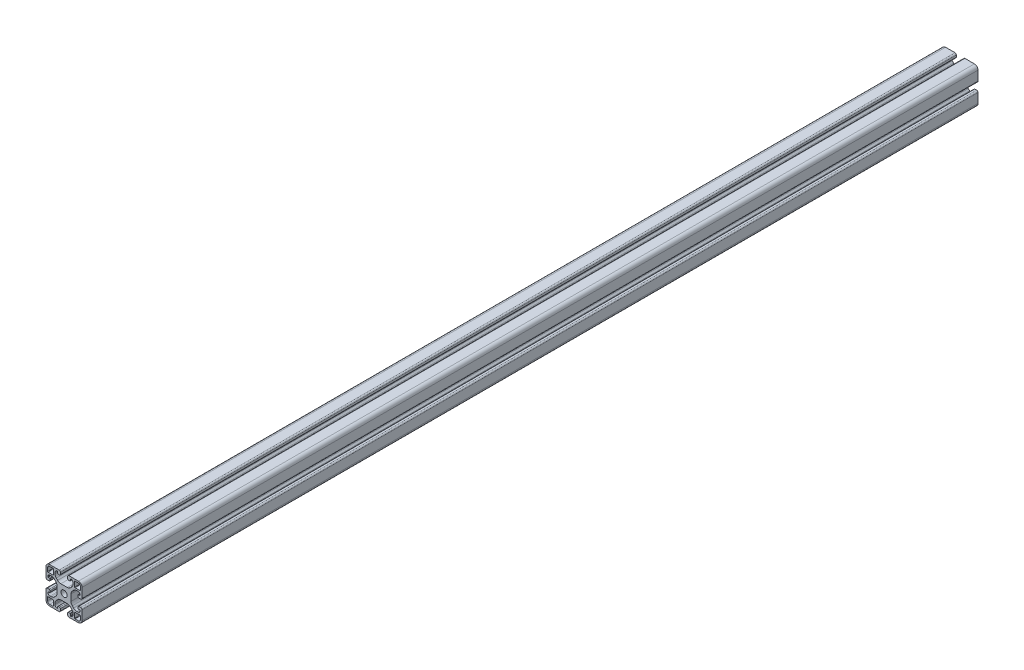
from build123d import *

# Parameters (mm, degrees)
ESQUISSE1_R        = 3.4
BOSS_EXTRU_1_DEPTH = 995


with BuildPart() as part:
    # Esquisse1 → Boss.-Extru.1 (new body)
    with BuildSketch(Plane(origin=(0, 0, -30), x_dir=(-1, 0, 0), z_dir=(0, 0, -1))):
        with BuildLine():
            Line((-4.5, 15), (-4.5, 13.5))
            ThreePointArc((-4.5, 13.5), (-4.353553391, 13.146446609), (-4, 13))
            Line((-4, 13), (-2.5, 13))
            ThreePointArc((-2.5, 13), (-2.146446609, 12.853553391), (-2, 12.5))
            ThreePointArc((-2, 12.5), (-2.732233047, 10.732233047), (-4.5, 10))
            Line((-4.5, 10), (-5.807611845, 10))
            ThreePointArc((-5.807611845, 10), (-7.721029006, 10.380602337), (-9.343145751, 11.464466094))
            Line((-9.343145751, 11.464466094), (-10.785533906, 12.906854249))
            ThreePointArc((-10.785533906, 12.906854249), (-11.869397663, 14.528970994), (-12.25, 16.442388155))
            Line((-12.25, 16.442388155), (-12.25, 23.557611845))
            ThreePointArc((-12.25, 23.557611845), (-11.869397663, 25.471029006), (-10.785533906, 27.093145751))
            Line((-10.785533906, 27.093145751), (-9.343145751, 28.535533906))
            ThreePointArc((-9.343145751, 28.535533906), (-7.721029006, 29.619397663), (-5.807611845, 30))
            Line((-5.807611845, 30), (-4.5, 30))
            ThreePointArc((-4.5, 30), (-2.732233047, 29.267766953), (-2, 27.5))
            ThreePointArc((-2, 27.5), (-2.146446609, 27.146446609), (-2.5, 27))
            Line((-2.5, 27), (-4, 27))
            ThreePointArc((-4, 27), (-4.353553391, 26.853553391), (-4.5, 26.5))
            Line((-4.5, 26.5), (-4.5, 25))
            ThreePointArc((-4.5, 25), (-4.207106781, 24.292893219), (-3.5, 24))
            Line((-3.5, 24), (-1.5, 24))
            ThreePointArc((-1.5, 24), (-0.439339828, 24.439339828), (0, 25.5))
            Line((0, 25.5), (0, 36))
            ThreePointArc((0, 36), (-1.171572875, 38.828427125), (-4, 40))
            Line((-4, 40), (-14.5, 40))
            ThreePointArc((-14.5, 40), (-15.560660172, 39.560660172), (-16, 38.5))
            Line((-16, 38.5), (-16, 36.5))
            ThreePointArc((-16, 36.5), (-15.707106781, 35.792893219), (-15, 35.5))
            Line((-15, 35.5), (-13.5, 35.5))
            ThreePointArc((-13.5, 35.5), (-13.146446609, 35.646446609), (-13, 36))
            Line((-13, 36), (-13, 37.5))
            ThreePointArc((-13, 37.5), (-12.853553391, 37.853553391), (-12.5, 38))
            ThreePointArc((-12.5, 38), (-10.732233047, 37.267766953), (-10, 35.5))
            Line((-10, 35.5), (-10, 34.192388155))
            ThreePointArc((-10, 34.192388155), (-10.380602337, 32.278970994), (-11.464466094, 30.656854249))
            Line((-11.464466094, 30.656854249), (-12.906854249, 29.214466094))
            ThreePointArc((-12.906854249, 29.214466094), (-14.528970994, 28.130602337), (-16.442388155, 27.75))
            Line((-16.442388155, 27.75), (-23.557611845, 27.75))
            ThreePointArc((-23.557611845, 27.75), (-25.471029006, 28.130602337), (-27.093145751, 29.214466094))
            Line((-27.093145751, 29.214466094), (-28.535533906, 30.656854249))
            ThreePointArc((-28.535533906, 30.656854249), (-29.619397663, 32.278970994), (-30, 34.192388155))
            Line((-30, 34.192388155), (-30, 35.5))
            ThreePointArc((-30, 35.5), (-29.267766953, 37.267766953), (-27.5, 38))
            ThreePointArc((-27.5, 38), (-27.146446609, 37.853553391), (-27, 37.5))
            Line((-27, 37.5), (-27, 36))
            ThreePointArc((-27, 36), (-26.853553391, 35.646446609), (-26.5, 35.5))
            Line((-26.5, 35.5), (-25, 35.5))
            ThreePointArc((-25, 35.5), (-24.292893219, 35.792893219), (-24, 36.5))
            Line((-24, 36.5), (-24, 38.5))
            ThreePointArc((-24, 38.5), (-24.439339828, 39.560660172), (-25.5, 40))
            Line((-25.5, 40), (-36, 40))
            ThreePointArc((-36, 40), (-38.828427125, 38.828427125), (-40, 36))
            Line((-40, 36), (-40, 25.5))
            ThreePointArc((-40, 25.5), (-39.560660172, 24.439339828), (-38.5, 24))
            Line((-38.5, 24), (-36.5, 24))
            ThreePointArc((-36.5, 24), (-35.792893219, 24.292893219), (-35.5, 25))
            Line((-35.5, 25), (-35.5, 26.5))
            ThreePointArc((-35.5, 26.5), (-35.646446609, 26.853553391), (-36, 27))
            Line((-36, 27), (-37.5, 27))
            ThreePointArc((-37.5, 27), (-37.853553391, 27.146446609), (-38, 27.5))
            ThreePointArc((-38, 27.5), (-37.267766953, 29.267766953), (-35.5, 30))
            Line((-35.5, 30), (-34.192388155, 30))
            ThreePointArc((-34.192388155, 30), (-32.278970994, 29.619397663), (-30.656854249, 28.535533906))
            Line((-30.656854249, 28.535533906), (-29.214466094, 27.093145751))
            ThreePointArc((-29.214466094, 27.093145751), (-28.130602337, 25.471029006), (-27.75, 23.557611845))
            Line((-27.75, 23.557611845), (-27.75, 16.442388155))
            ThreePointArc((-27.75, 16.442388155), (-28.130602337, 14.528970994), (-29.214466094, 12.906854249))
            Line((-29.214466094, 12.906854249), (-30.656854249, 11.464466094))
            ThreePointArc((-30.656854249, 11.464466094), (-32.278970994, 10.380602337), (-34.192388155, 10))
            Line((-34.192388155, 10), (-35.5, 10))
            ThreePointArc((-35.5, 10), (-37.267766953, 10.732233047), (-38, 12.5))
            ThreePointArc((-38, 12.5), (-37.853553391, 12.853553391), (-37.5, 13))
            Line((-37.5, 13), (-36, 13))
            ThreePointArc((-36, 13), (-35.646446609, 13.146446609), (-35.5, 13.5))
            Line((-35.5, 13.5), (-35.5, 15))
            ThreePointArc((-35.5, 15), (-35.792893219, 15.707106781), (-36.5, 16))
            Line((-36.5, 16), (-38.5, 16))
            ThreePointArc((-38.5, 16), (-39.560660172, 15.560660172), (-40, 14.5))
            Line((-40, 14.5), (-40, 4))
            ThreePointArc((-40, 4), (-38.828427125, 1.171572875), (-36, 0))
            Line((-36, 0), (-25.5, 0))
            ThreePointArc((-25.5, 0), (-24.439339828, 0.439339828), (-24, 1.5))
            Line((-24, 1.5), (-24, 3.5))
            ThreePointArc((-24, 3.5), (-24.292893219, 4.207106781), (-25, 4.5))
            Line((-25, 4.5), (-26.5, 4.5))
            ThreePointArc((-26.5, 4.5), (-26.853553391, 4.353553391), (-27, 4))
            Line((-27, 4), (-27, 2.5))
            ThreePointArc((-27, 2.5), (-27.146446609, 2.146446609), (-27.5, 2))
            ThreePointArc((-27.5, 2), (-29.267766953, 2.732233047), (-30, 4.5))
            Line((-30, 4.5), (-30, 5.807611845))
            ThreePointArc((-30, 5.807611845), (-29.619397663, 7.721029006), (-28.535533906, 9.343145751))
            Line((-28.535533906, 9.343145751), (-27.093145751, 10.785533906))
            ThreePointArc((-27.093145751, 10.785533906), (-25.471029006, 11.869397663), (-23.557611845, 12.25))
            Line((-23.557611845, 12.25), (-16.442388155, 12.25))
            ThreePointArc((-16.442388155, 12.25), (-14.528970994, 11.869397663), (-12.906854249, 10.785533906))
            Line((-12.906854249, 10.785533906), (-11.464466094, 9.343145751))
            ThreePointArc((-11.464466094, 9.343145751), (-10.380602337, 7.721029006), (-10, 5.807611845))
            Line((-10, 5.807611845), (-10, 4.5))
            ThreePointArc((-10, 4.5), (-10.732233047, 2.732233047), (-12.5, 2))
            ThreePointArc((-12.5, 2), (-12.853553391, 2.146446609), (-13, 2.5))
            Line((-13, 2.5), (-13, 4))
            ThreePointArc((-13, 4), (-13.146446609, 4.353553391), (-13.5, 4.5))
            Line((-13.5, 4.5), (-15, 4.5))
            ThreePointArc((-15, 4.5), (-15.707106781, 4.207106781), (-16, 3.5))
            Line((-16, 3.5), (-16, 1.5))
            ThreePointArc((-16, 1.5), (-15.560660172, 0.439339828), (-14.5, 0))
            Line((-14.5, 0), (-4, 0))
            ThreePointArc((-4, 0), (-1.171572875, 1.171572875), (0, 4))
            Line((0, 4), (0, 14.5))
            ThreePointArc((0, 14.5), (-0.439339828, 15.560660172), (-1.5, 16))
            Line((-1.5, 16), (-3.5, 16))
            ThreePointArc((-3.5, 16), (-4.207106781, 15.707106781), (-4.5, 15))
        make_face()
        with Locations((-20, 20)):
            Circle(ESQUISSE1_R, mode=Mode.SUBTRACT)
        with BuildLine():
            Line((-4, 1.8), (-7.7, 1.8))
            ThreePointArc((-7.7, 1.8), (-8.053553391, 1.946446609), (-8.2, 2.3))
            Line((-8.2, 2.3), (-8.2, 7.7))
            ThreePointArc((-8.2, 7.7), (-8.053553391, 8.053553391), (-7.7, 8.2))
            Line((-7.7, 8.2), (-2.3, 8.2))
            ThreePointArc((-2.3, 8.2), (-1.946446609, 8.053553391), (-1.8, 7.7))
            Line((-1.8, 7.7), (-1.8, 4))
            ThreePointArc((-1.8, 4), (-2.444365081, 2.444365081), (-4, 1.8))
        make_face(mode=Mode.SUBTRACT)
        with BuildLine():
            Line((-38.2, 4), (-38.2, 7.7))
            ThreePointArc((-38.2, 7.7), (-38.053553391, 8.053553391), (-37.7, 8.2))
            Line((-37.7, 8.2), (-32.3, 8.2))
            ThreePointArc((-32.3, 8.2), (-31.946446609, 8.053553391), (-31.8, 7.7))
            Line((-31.8, 7.7), (-31.8, 2.3))
            ThreePointArc((-31.8, 2.3), (-31.946446609, 1.946446609), (-32.3, 1.8))
            Line((-32.3, 1.8), (-36, 1.8))
            ThreePointArc((-36, 1.8), (-37.555634919, 2.444365081), (-38.2, 4))
        make_face(mode=Mode.SUBTRACT)
        with BuildLine():
            Line((-36, 38.2), (-32.3, 38.2))
            ThreePointArc((-32.3, 38.2), (-31.946446609, 38.053553391), (-31.8, 37.7))
            Line((-31.8, 37.7), (-31.8, 32.3))
            ThreePointArc((-31.8, 32.3), (-31.946446609, 31.946446609), (-32.3, 31.8))
            Line((-32.3, 31.8), (-37.7, 31.8))
            ThreePointArc((-37.7, 31.8), (-38.053553391, 31.946446609), (-38.2, 32.3))
            Line((-38.2, 32.3), (-38.2, 36))
            ThreePointArc((-38.2, 36), (-37.555634919, 37.555634919), (-36, 38.2))
        make_face(mode=Mode.SUBTRACT)
        with BuildLine():
            Line((-1.8, 36), (-1.8, 32.3))
            ThreePointArc((-1.8, 32.3), (-1.946446609, 31.946446609), (-2.3, 31.8))
            Line((-2.3, 31.8), (-7.7, 31.8))
            ThreePointArc((-7.7, 31.8), (-8.053553391, 31.946446609), (-8.2, 32.3))
            Line((-8.2, 32.3), (-8.2, 37.7))
            ThreePointArc((-8.2, 37.7), (-8.053553391, 38.053553391), (-7.7, 38.2))
            Line((-7.7, 38.2), (-4, 38.2))
            ThreePointArc((-4, 38.2), (-2.444365081, 37.555634919), (-1.8, 36))
        make_face(mode=Mode.SUBTRACT)
    extrude(amount=-BOSS_EXTRU_1_DEPTH)


solid = part.part
